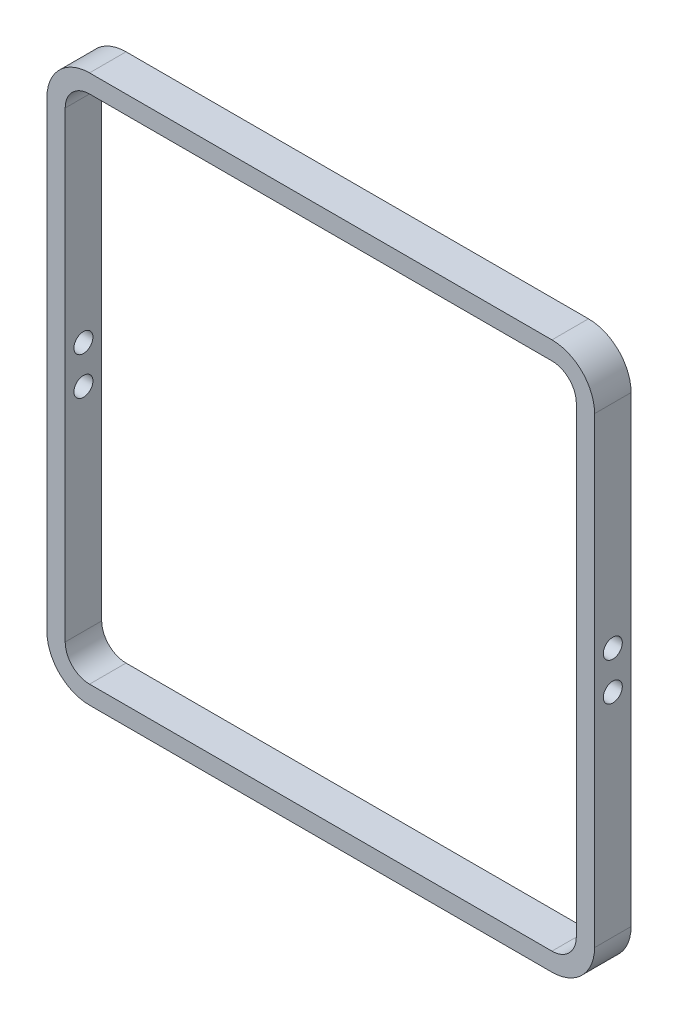
from build123d import *

# Parameters (mm, degrees)
SKETCH1_W           = 225
SKETCH1_H           = 225
SKETCH1_W_2         = 210
SKETCH1_H_2         = 210
BOSS_EXTRUDE1_DEPTH = 15
SKETCH2_R           = 3.9
CUT_EXTRUDE1_DEPTH  = 253.004464246
FILLET1_R           = 10
FILLET2_R           = 17.5


with BuildPart() as part:
    # Sketch1 → Boss-Extrude1 (new body)
    with BuildSketch(Plane(origin=(0, 0, 0), x_dir=(0, 1, 0), z_dir=(0, 0, 1))):
        Rectangle(SKETCH1_W, SKETCH1_H)
        Rectangle(SKETCH1_W_2, SKETCH1_H_2, mode=Mode.SUBTRACT)
    extrude(amount=BOSS_EXTRUDE1_DEPTH)

    # Sketch2 → Cut-Extrude1 (cut, through all)
    with BuildSketch(Plane.YZ.offset(112.5)):
        with Locations(Location((-7.8, 7.5, 0), (0, 0, 270))):
            Circle(SKETCH2_R)
        with Locations(Location((7.8, 7.5, 0), (0, 0, 90))):
            Circle(SKETCH2_R)
    extrude(amount=-CUT_EXTRUDE1_DEPTH, mode=Mode.SUBTRACT)

    # Fillet1
    fillet1_edges = [part.edges().sort_by_distance(p)[0] for p in [
        (105, 105, 7.5),
        (-105, 105, 7.5),
        (-105, -105, 7.5),
        (105, -105, 7.5),
    ]]
    fillet(fillet1_edges, radius=FILLET1_R)

    # Fillet2
    fillet2_edges = [part.edges().sort_by_distance(p)[0] for p in [
        (112.5, 112.5, 7.5),
        (112.5, -112.5, 7.5),
        (-112.5, -112.5, 7.5),
        (-112.5, 112.5, 7.5),
    ]]
    fillet(fillet2_edges, radius=FILLET2_R)


solid = part.part
